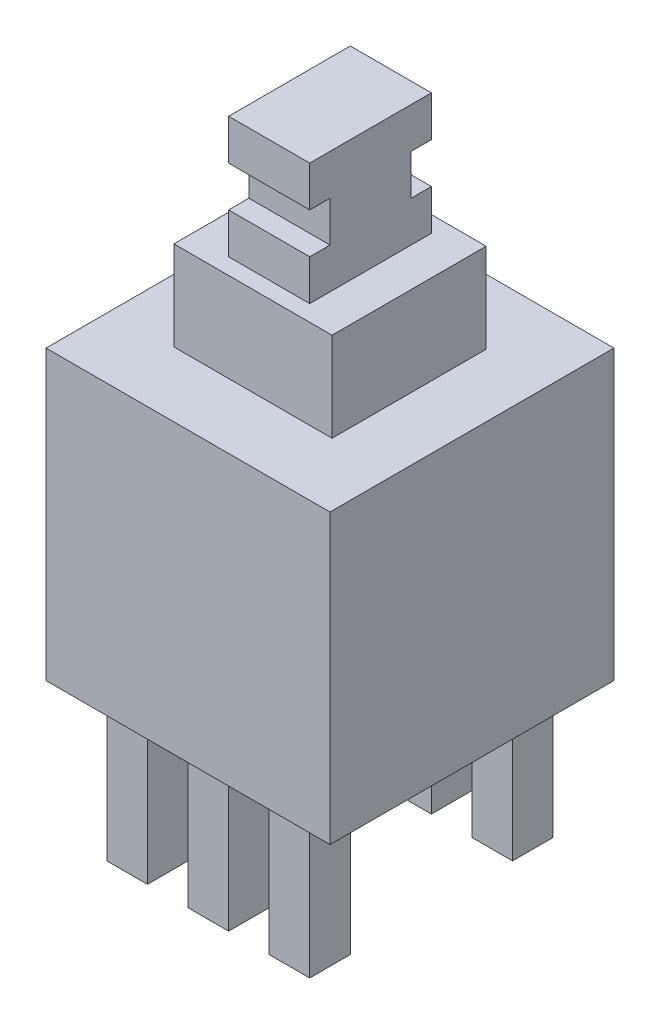
from build123d import *

# Parameters (mm, degrees)
SKETCH1_W           = 7
SKETCH1_H           = 7
BOSS_EXTRUDE1_DEPTH = 7.1
SKETCH2_W           = 3.9
SKETCH2_H           = 3.8
BOSS_EXTRUDE2_DEPTH = 2.2
SKETCH3_W           = 2
SKETCH3_H           = 3
BOSS_EXTRUDE3_DEPTH = 3
SKETCH4_W           = 1
SKETCH4_H           = 1
BOSS_EXTRUDE4_DEPTH = 3.6
SKETCH5_W           = 0.5
SKETCH5_H           = 1
CUT_EXTRUDE1_DEPTH  = 14.556917054


with BuildPart() as part:
    # Sketch1 → Boss-Extrude1 (new body)
    with BuildSketch(Plane(origin=(0, 0, 0), x_dir=(1, 0, 0), z_dir=(0, 1, 0))):
        Rectangle(SKETCH1_W, SKETCH1_H)
    extrude(amount=BOSS_EXTRUDE1_DEPTH)

    # Sketch2 → Boss-Extrude2 (add)
    with BuildSketch(Plane(origin=(0, 7.1, 0), x_dir=(1, 0, 0), z_dir=(0, 1, 0))):
        Rectangle(SKETCH2_W, SKETCH2_H)
    extrude(amount=BOSS_EXTRUDE2_DEPTH)

    # Sketch3 → Boss-Extrude3 (add)
    with BuildSketch(Plane(origin=(0, 9.3, 0), x_dir=(1, 0, 0), z_dir=(0, 1, 0))):
        Rectangle(SKETCH3_W, SKETCH3_H)
    extrude(amount=BOSS_EXTRUDE3_DEPTH)

    # Sketch4 → Boss-Extrude4 (add)
    with BuildSketch(Plane.XZ):
        with Locations((0, 2.5)):
            Rectangle(SKETCH4_W, SKETCH4_H)
        with Locations((-2, 2.5)):
            Rectangle(SKETCH4_W, SKETCH4_H)
        with Locations((2, 2.5)):
            Rectangle(SKETCH4_W, SKETCH4_H)
        with Locations((0, -2.5)):
            Rectangle(SKETCH4_W, SKETCH4_H)
        with Locations((2, -2.5)):
            Rectangle(SKETCH4_W, SKETCH4_H)
        with Locations((-2, -2.5)):
            Rectangle(SKETCH4_W, SKETCH4_H)
    extrude(amount=BOSS_EXTRUDE4_DEPTH)

    # Sketch5 → Cut-Extrude1 (cut, through all)
    with BuildSketch(Plane(origin=(1, 0, 0), x_dir=(0, 0, -1), z_dir=(1, 0, 0))):
        with Locations((-1.25, 10.8)):
            Rectangle(SKETCH5_W, SKETCH5_H)
        with Locations((1.25, 10.8)):
            Rectangle(SKETCH5_W, SKETCH5_H)
    extrude(amount=-CUT_EXTRUDE1_DEPTH, mode=Mode.SUBTRACT)


solid = part.part
